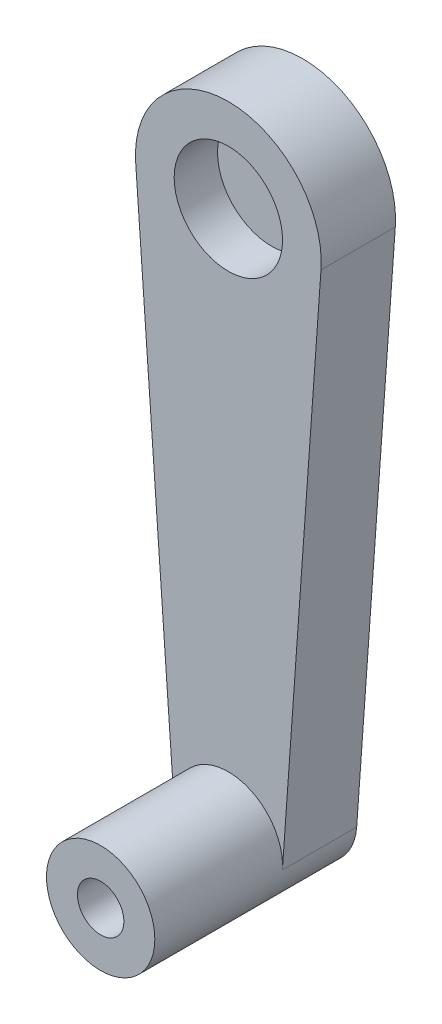
from build123d import *

# Parameters (mm, degrees)
SKETCH1_R           = 3.5
SKETCH1_R_2         = 1.5
BOSS_EXTRUDE1_DEPTH = 8.25
BOSS_EXTRUDE2_START = 2.8
SKETCH2_R           = 6
SKETCH2_R_2         = 3.5
SKETCH2_R_3         = 1.5
BOSS_EXTRUDE2_DEPTH = 2.8
BOSS_EXTRUDE3_START = 4.8
SKETCH2_3_R         = 6
SKETCH2_3_R_2       = 3.5
SKETCH2_3_R_3       = 1.5
BOSS_EXTRUDE3_DEPTH = 2


with BuildPart() as part:
    # Sketch1 → Boss-Extrude1 (new body)
    with BuildSketch(Plane.XY):
        Circle(SKETCH1_R)
        Circle(SKETCH1_R_2, mode=Mode.SUBTRACT)
    extrude(amount=BOSS_EXTRUDE1_DEPTH)

    # Sketch2 → Boss-Extrude2 (add)
    # profile 1 of 4: a face of its own
    with BuildSketch(Plane(origin=(0, 0, 0), x_dir=(-1, 0, 0), z_dir=(0, 0, -1)).offset(BOSS_EXTRUDE2_START)):
        with BuildLine():
            ThreePointArc((5.984674304, 34.571428571), (0, 29), (-5.984674304, 34.571428571))
            Line((-5.984674304, 34.571428571), (-3.491060011, -0.25))
            ThreePointArc((-3.491060011, -0.25), (-0.125079898, 3.497764289), (3.5, 0))
            ThreePointArc((3.5, 0), (3.497764289, -0.125079898), (3.491060011, -0.25))
            Line((3.491060011, -0.25), (5.984674304, 34.571428571))
        make_face()
    # profile 2 of 4: a face of its own
    with BuildSketch(Plane(origin=(0, 0, 0), x_dir=(-1, 0, 0), z_dir=(0, 0, -1)).offset(BOSS_EXTRUDE2_START)):
        with Locations((0, 35)):
            Circle(SKETCH2_R)
        with Locations((0, 35)):
            Circle(SKETCH2_R_2, mode=Mode.SUBTRACT)
    # profile 3 of 4: a face of its own
    with BuildSketch(Plane(origin=(0, 0, 0), x_dir=(-1, 0, 0), z_dir=(0, 0, -1)).offset(BOSS_EXTRUDE2_START)):
        with Locations(Location((0, 0, 0), (0, 0, 355.903956242))):
            Circle(SKETCH2_R_2)
        with Locations(Location((0, 0, 0), (0, 0, 180))):
            Circle(SKETCH2_R_3, mode=Mode.SUBTRACT)
    # profile 4 of 4: a face of its own
    with BuildSketch(Plane(origin=(0, 0, 0), x_dir=(-1, 0, 0), z_dir=(0, 0, -1)).offset(BOSS_EXTRUDE2_START)):
        with Locations(Location((0, 0, 0), (0, 0, 180))):
            Circle(SKETCH2_R_3)
    extrude(amount=-BOSS_EXTRUDE2_DEPTH)

    # Sketch2<3> → Boss-Extrude3 (add)
    # profile 1 of 5: a face of its own
    with BuildSketch(Plane(origin=(0, 0, 0), x_dir=(-1, 0, 0), z_dir=(0, 0, -1)).offset(BOSS_EXTRUDE3_START)):
        with Locations((0, 35)):
            Circle(SKETCH2_3_R)
        with Locations((0, 35)):
            Circle(SKETCH2_3_R_2, mode=Mode.SUBTRACT)
    # profile 2 of 5: a face of its own
    with BuildSketch(Plane(origin=(0, 0, 0), x_dir=(-1, 0, 0), z_dir=(0, 0, -1)).offset(BOSS_EXTRUDE3_START)):
        with BuildLine():
            ThreePointArc((5.984674304, 34.571428571), (0, 29), (-5.984674304, 34.571428571))
            Line((-5.984674304, 34.571428571), (-3.491060011, -0.25))
            ThreePointArc((-3.491060011, -0.25), (-0.125079898, 3.497764289), (3.5, 0))
            ThreePointArc((3.5, 0), (3.497764289, -0.125079898), (3.491060011, -0.25))
            Line((3.491060011, -0.25), (5.984674304, 34.571428571))
        make_face()
    # profile 3 of 5: a face of its own
    with BuildSketch(Plane(origin=(0, 0, 0), x_dir=(-1, 0, 0), z_dir=(0, 0, -1)).offset(BOSS_EXTRUDE3_START)):
        with Locations(Location((0, 0, 0), (0, 0, 355.903956242))):
            Circle(SKETCH2_3_R_2)
        with Locations(Location((0, 0, 0), (0, 0, 180))):
            Circle(SKETCH2_3_R_3, mode=Mode.SUBTRACT)
    # profile 4 of 5: a face of its own
    with BuildSketch(Plane(origin=(0, 0, 0), x_dir=(-1, 0, 0), z_dir=(0, 0, -1)).offset(BOSS_EXTRUDE3_START)):
        with Locations((0, 35)):
            Circle(SKETCH2_3_R_2)
    # profile 5 of 5: a face of its own
    with BuildSketch(Plane(origin=(0, 0, 0), x_dir=(-1, 0, 0), z_dir=(0, 0, -1)).offset(BOSS_EXTRUDE3_START)):
        with Locations(Location((0, 0, 0), (0, 0, 180))):
            Circle(SKETCH2_3_R_3)
    extrude(amount=-BOSS_EXTRUDE3_DEPTH)


solid = part.part
